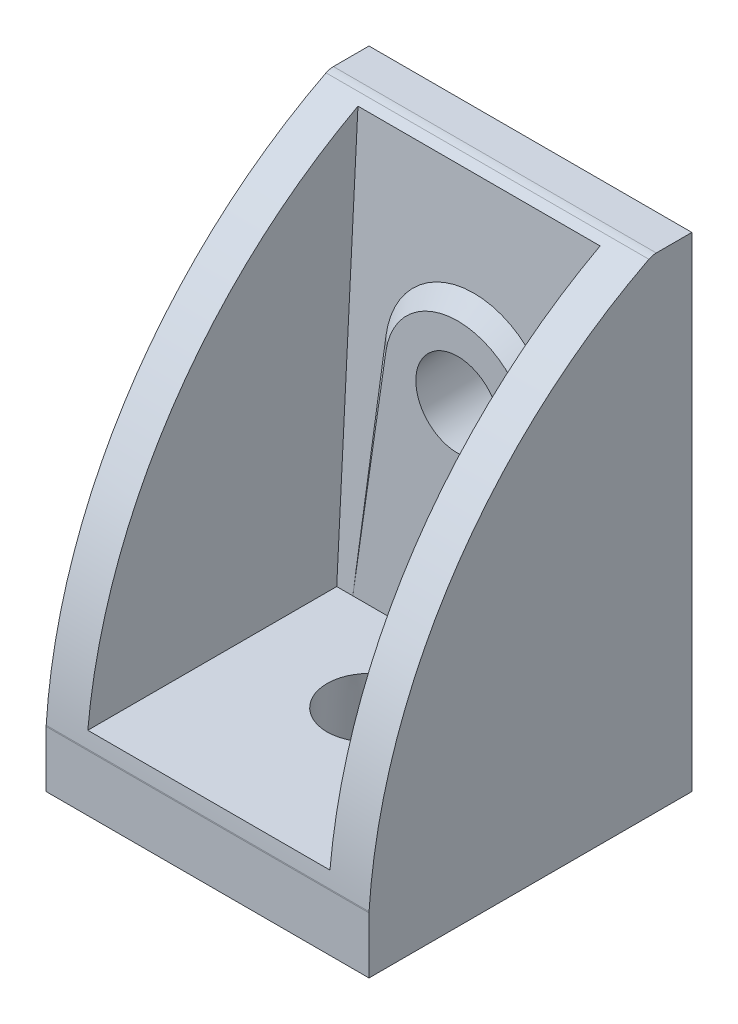
from build123d import *

# Parameters (mm, degrees)
BOSS_EXTRUDE1_DEPTH      = 20
CUT_EXTRUDE1_DEPTH       = 7.5
CUT_EXTRUDE1_DEPTH_BACK  = 7.5
BOSS_EXTRUDE2_DEPTH      = 3
BOSS_EXTRUDE2_DEPTH_BACK = 3
BOSS_EXTRUDE3_DEPTH      = 3
BOSS_EXTRUDE3_DEPTH_BACK = 3
BOSS_EXTRUDE4_DEPTH      = 2
BOSS_EXTRUDE4_DRAFT      = 45
SKETCH6_W                = 5.85
SKETCH6_H                = 5.85
BOSS_EXTRUDE5_DEPTH      = 1.5
BOSS_EXTRUDE5_DRAFT      = -6
CUT_EXTRUDE2_DEPTH       = 1
CUT_EXTRUDE2_DRAFT       = 6


with BuildPart() as part:
    # Sketch1 → Boss-Extrude1 (new body)
    with BuildSketch(Plane(origin=(0, 0, 0), x_dir=(0, 0, -1), z_dir=(1, 0, 0))):
        with BuildLine():
            Line((-20, 0), (0, 0))
            Line((0, 0), (0, 30))
            Line((0, 30), (-2.204776263, 30))
            ThreePointArc((-2.204776263, 30), (-2.439297051, 29.972111105), (-2.660736787, 29.89))
            ThreePointArc((-2.660736787, 29.89), (-14.796751679, 19.007748284), (-19.997741935, 3.559254499))
            ThreePointArc((-19.997741935, 3.559254499), (-19.999435324, 3.525691371), (-20, 3.492090296))
            Line((-20, 3.492090296), (-20, 0))
        make_face()
    extrude(amount=BOSS_EXTRUDE1_DEPTH)

    # Sketch2 → Cut-Extrude1 (cut, two sides: drawn at the far end of the back side and taken through both)
    with BuildSketch(Plane(origin=(10, 0, 0), x_dir=(0, 0, -1), z_dir=(1, 0, 0)).offset(-CUT_EXTRUDE1_DEPTH_BACK)):
        Polygon((-20, 4.5), (-4.5, 4.5), (-3.163601628, 30), (-20, 30), align=None)
    extrude(amount=CUT_EXTRUDE1_DEPTH + CUT_EXTRUDE1_DEPTH_BACK, mode=Mode.SUBTRACT)

    # Sketch3 → Boss-Extrude2 (add, two sides: drawn at the far end of the back side and taken through both)
    with BuildSketch(Plane(origin=(10, 0, 0), x_dir=(0, 0, -1), z_dir=(1, 0, 0)).offset(-BOSS_EXTRUDE2_DEPTH_BACK)):
        Polygon((-0.5, 23.5), (1, 24.366025404), (1, 25.633974596), (-0.5, 26.5), align=None)
    extrude(amount=BOSS_EXTRUDE2_DEPTH + BOSS_EXTRUDE2_DEPTH_BACK)

    # Sketch4 → Boss-Extrude3 (add, two sides: drawn at the far end of the back side and taken through both)
    with BuildSketch(Plane(origin=(10, 0, 0), x_dir=(0, 0, -1), z_dir=(1, 0, 0)).offset(-BOSS_EXTRUDE3_DEPTH_BACK)):
        Polygon((-0.5, 4), (1, 4.866025404), (1, 12.133974596), (-0.5, 13), align=None)
    extrude(amount=BOSS_EXTRUDE3_DEPTH + BOSS_EXTRUDE3_DEPTH_BACK)


with BuildPart() as boss_extrude4_tool:
    # Sketch5 → Boss-Extrude4 (with draft: the straight prism first)
    with BuildSketch(Plane.XY.offset(4.5)):
        with BuildLine():
            Line((3.495537436, 4.5), (16.504462564, 4.5))
            Line((16.504462564, 4.5), (14.453431241, 18.645716799))
            ThreePointArc((14.453431241, 18.645716799), (10, 22.5), (5.546568759, 18.645716799))
            Line((5.546568759, 18.645716799), (3.495537436, 4.5))
        make_face()
    extrude(amount=-BOSS_EXTRUDE4_DEPTH)
    # Boss-Extrude4: the draft: its side faces are tilted about the plane it starts from
    boss_extrude4_sides = [boss_extrude4_tool.faces().sort_by_distance(p)[0] for p in [
        (10, 22.5, 3.5),
        (4.521053098, 11.572858399, 3.5),
        (10, 4.5, 3.5),
        (15.478946902, 11.572858399, 3.5),
    ]]
    draft(boss_extrude4_sides, Plane.XY.offset(4.5), BOSS_EXTRUDE4_DRAFT)


with BuildPart() as part_1:
    add(part.part)

    # Boss-Extrude4: add boss_extrude4_tool
    add(boss_extrude4_tool.part)


with BuildPart() as boss_extrude5_tool:
    # Sketch6 → Boss-Extrude5 (with draft: the straight prism first)
    with BuildSketch(Plane(origin=(0, 0.5, 0), x_dir=(1, 0, 0), z_dir=(0, 1, 0))):
        with Locations((10, -10)):
            Rectangle(SKETCH6_W, SKETCH6_H)
    extrude(amount=-BOSS_EXTRUDE5_DEPTH)
    # Boss-Extrude5: the draft: its side faces are tilted about the plane it starts from
    boss_extrude5_sides = [boss_extrude5_tool.faces().sort_by_distance(p)[0] for p in [
        (10, -0.25, 12.925),
        (12.925, -0.25, 10),
        (10, -0.25, 7.075),
        (7.075, -0.25, 10),
    ]]
    draft(boss_extrude5_sides, Plane(origin=(0, 0.5, 0), x_dir=(1, 0, 0), z_dir=(0, 1, 0)), BOSS_EXTRUDE5_DRAFT)


with BuildPart() as part_2:
    add(part_1.part)

    # Boss-Extrude5: add boss_extrude5_tool
    add(boss_extrude5_tool.part)


with BuildPart() as cut_extrude2_tool:
    # Sketch7 → Cut-Extrude2 (with draft: the straight prism first)
    with BuildSketch(Plane(origin=(0, 0, 0), x_dir=(1, 0, 0), z_dir=(0, 1, 0))):
        Polygon((7.075, -9.165), (7.075, -10.835), (9.165, -10.835), (9.165, -12.925), (10.835, -12.925), (10.835, -10.835), (12.925, -10.835), (12.925, -9.165), (10.835, -9.165), (10.835, -7.075), (9.165, -7.075), (9.165, -9.165), align=None)
    extrude(amount=-CUT_EXTRUDE2_DEPTH)
    # Cut-Extrude2: the draft: its side faces are tilted about the plane it starts from
    cut_extrude2_sides = [cut_extrude2_tool.faces().sort_by_distance(p)[0] for p in [
        (7.075, -0.5, 10),
        (8.12, -0.5, 10.835),
        (9.165, -0.5, 11.88),
        (10, -0.5, 12.925),
        (10.835, -0.5, 11.88),
        (11.88, -0.5, 10.835),
        (12.925, -0.5, 10),
        (11.88, -0.5, 9.165),
        (10.835, -0.5, 8.12),
        (10, -0.5, 7.075),
        (9.165, -0.5, 8.12),
        (8.12, -0.5, 9.165),
    ]]
    draft(cut_extrude2_sides, Plane(origin=(0, 0, 0), x_dir=(1, 0, 0), z_dir=(0, 1, 0)), CUT_EXTRUDE2_DRAFT)


with BuildPart() as part_3:
    add(part_2.part)

    # Cut-Extrude2: cut by cut_extrude2_tool
    add(cut_extrude2_tool.part, mode=Mode.SUBTRACT)

    # Sketch8 → Cut-Revolve1 (revolve, cut)
    with BuildSketch(Plane(origin=(10, 0, 0), x_dir=(0, 0, -1), z_dir=(1, 0, 0)), mode=Mode.PRIVATE) as cut_revolve1_sk:
        Polygon((-4.5, 18), (-4.5, 20.6), (0, 20.835835007), (0, 18), align=None)
    revolve(cut_revolve1_sk.sketch.rotate(Axis((10, 18, 0), (0, 0, 1)), 270), axis=Axis((10, 18, 0), (0, 0, 1)), mode=Mode.SUBTRACT)

    # Sketch9 → Cut-Revolve2 (revolve, cut)
    with BuildSketch(Plane(origin=(10, 0, 0), x_dir=(0, 0, -1), z_dir=(1, 0, 0)), mode=Mode.PRIVATE) as cut_revolve2_sk:
        Polygon((-10, 4.5), (-7.4, 4.5), (-7.111757214, -1), (-10, -1), align=None)
    revolve(cut_revolve2_sk.sketch.rotate(Axis((10, -1, 10), (0, 1, 0)), 17.124314287), axis=Axis((10, -1, 10), (0, 1, 0)), mode=Mode.SUBTRACT)


solid = part_3.part
